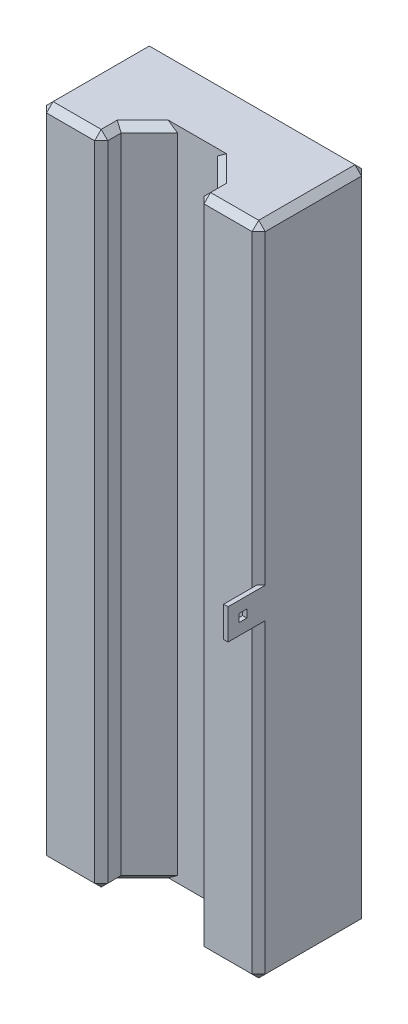
from build123d import *

# Parameters (mm, degrees)
SKETCH1_W                = 50
SKETCH1_H                = 150
BOSS_EXTRUDE1_DEPTH      = 25
CUT_EXTRUDE1_DEPTH       = 161.078105936
CHAMFER1_SIZE            = 1.5
BOSS_EXTRUDE2_DEPTH      = 7
BOSS_EXTRUDE2_DEPTH_BACK = 10
SKETCH3_W                = 1
SKETCH3_H                = 7
SKETCH4_W                = 1.8
SKETCH4_H                = 1.8
CUT_EXTRUDE2_DEPTH       = 7


with BuildPart() as part:
    # Sketch1 → Boss-Extrude1 (new body)
    with BuildSketch(Plane.XY):
        with Locations((25, 75)):
            Rectangle(SKETCH1_W, SKETCH1_H)
    extrude(amount=BOSS_EXTRUDE1_DEPTH)

    # Sketch2 → Cut-Extrude1 (cut, through all)
    with BuildSketch(Plane.XZ):
        Polygon((29.556349186, 36), (20.443650814, 36), (14, 29.556349186), (14, 20.443650814), (20.443650814, 14), (29.556349186, 14), (36, 20.443650814), (36, 29.556349186), align=None)
    extrude(amount=-CUT_EXTRUDE1_DEPTH, mode=Mode.SUBTRACT)

    # Chamfer1
    chamfer1_edges = [part.edges().sort_by_distance(p)[0] for p in [
        (50, 75, 25),
        (43, 150, 25),
        (43, 0, 25),
        (7, 150, 25),
        (14, 75, 25),
        (36, 75, 25),
        (36, 150, 22.721825407),
        (14, 150, 22.721825407),
        (36, 0, 22.721825407),
        (14, 0, 22.721825407),
        (17.221825407, 0, 17.221825407),
        (32.778174593, 0, 17.221825407),
        (32.778174593, 150, 17.221825407),
        (17.221825407, 150, 17.221825407),
        (0, 75, 25),
        (25, 150, 0),
        (50, 75, 0),
        (25, 0, 0),
        (0, 75, 0),
        (7, 0, 25),
        (0, 150, 12.5),
        (50, 150, 12.5),
        (50, 0, 12.5),
        (0, 0, 12.5),
    ]]
    chamfer(chamfer1_edges, length=CHAMFER1_SIZE)

    # Sketch3 → Boss-Extrude2 (add, two sides: drawn at the far end of the back side and taken through both)
    with BuildSketch(Plane.XY.offset(25).offset(-BOSS_EXTRUDE2_DEPTH_BACK)):
        with Locations((49.5, 75)):
            Rectangle(SKETCH3_W, SKETCH3_H)
    extrude(amount=BOSS_EXTRUDE2_DEPTH + BOSS_EXTRUDE2_DEPTH_BACK)

    # Sketch4 → Cut-Extrude2 (cut)
    with BuildSketch(Plane(origin=(50, 0, 0), x_dir=(0, 0, -1), z_dir=(1, 0, 0))):
        with Locations((-28.6, 75)):
            Rectangle(SKETCH4_W, SKETCH4_H)
    extrude(amount=-CUT_EXTRUDE2_DEPTH, mode=Mode.SUBTRACT)


solid = part.part
